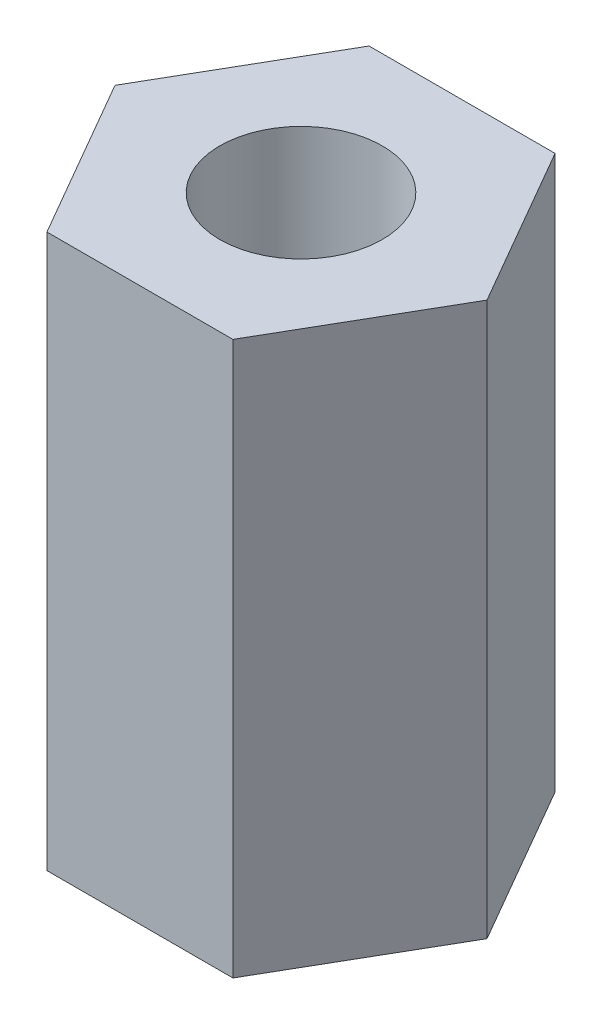
from build123d import *

# Parameters (mm, degrees)
SKETCH2_R           = 1.175
BOSS_EXTRUDE2_DEPTH = 8


with BuildPart() as part:
    # Sketch2 → Boss-Extrude2 (new body)
    with BuildSketch(Plane(origin=(0, 0, 0), x_dir=(1, 0, 0), z_dir=(0, 1, 0))):
        Polygon((2.690452254, 0), (1.345226127, 2.33), (-1.345226127, 2.33), (-2.690452254, 0), (-1.345226127, -2.33), (1.345226127, -2.33), align=None)
        with Locations(Location((0, 0, 0), (0, 0, 270))):
            Circle(SKETCH2_R, mode=Mode.SUBTRACT)
    extrude(amount=BOSS_EXTRUDE2_DEPTH)


solid = part.part
